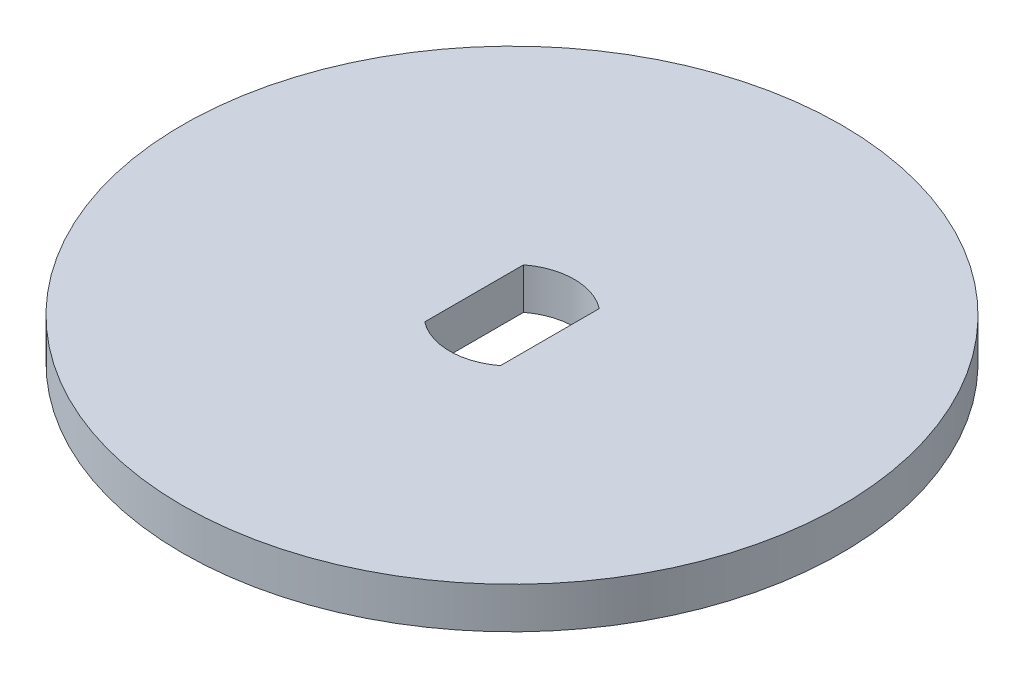
from build123d import *

# Parameters (mm, degrees)
SKETCH1_R           = 25.4
BOSS_EXTRUDE1_DEPTH = 3.175


with BuildPart() as part:
    # Sketch1 → Boss-Extrude1 (new body)
    with BuildSketch(Plane(origin=(0, 0, 0), x_dir=(1, 0, 0), z_dir=(0, 1, 0))):
        with Locations(Location((0, 0, 0), (0, 0, 270))):
            Circle(SKETCH1_R)
        with BuildLine():
            Line((-2.919571886, 3.81), (-2.919571886, -3.81))
            ThreePointArc((-2.919571886, -3.81), (0, -4.8), (2.919571886, -3.81))
            Line((2.919571886, -3.81), (2.919571886, 3.81))
            ThreePointArc((2.919571886, 3.81), (0, 4.8), (-2.919571886, 3.81))
        make_face(mode=Mode.SUBTRACT)
    extrude(amount=-BOSS_EXTRUDE1_DEPTH)


solid = part.part
